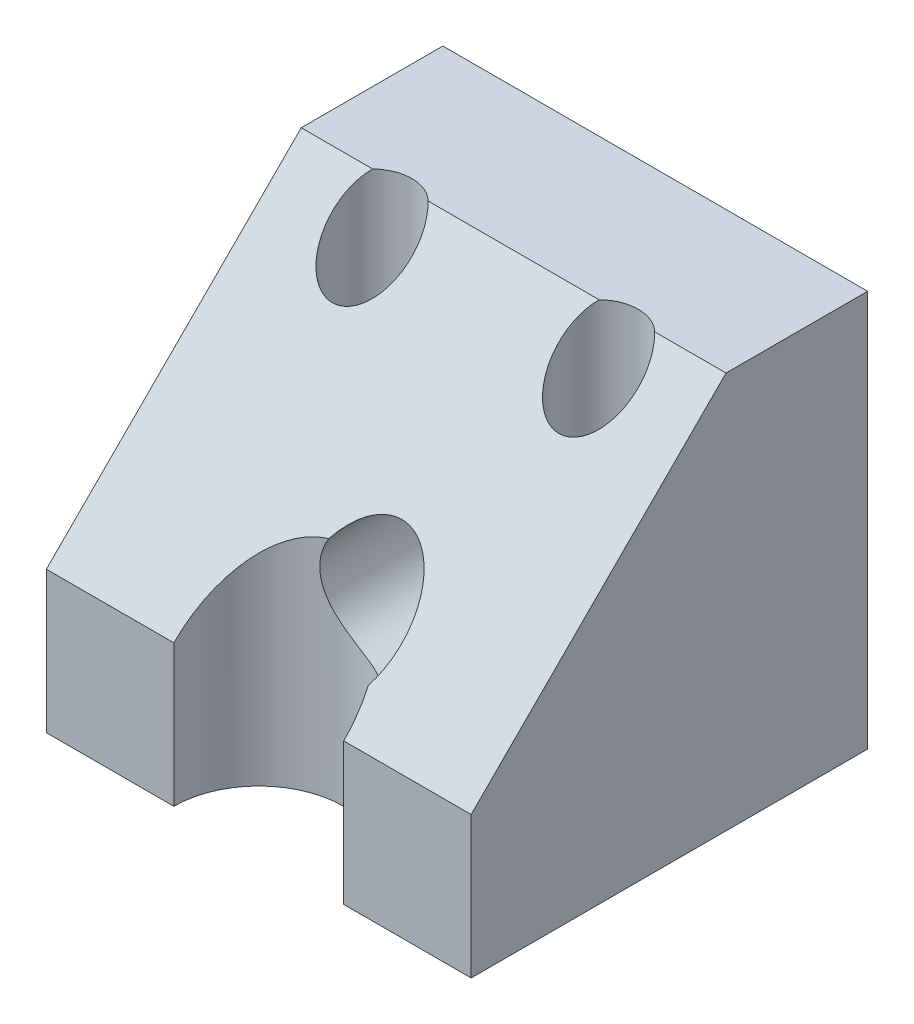
from build123d import *

# Parameters (mm, degrees)
EXTRUDE_1_DEPTH          = 15
CUT_EXTRUDE_1_DEPTH      = 25.839484697
CUT_EXTRUDE_1_DEPTH_BACK = 25.839484697
SKETCH_2_R               = 1.4
SKETCH_3_R               = 1.9
CUT_EXTRUDE_2_DEPTH      = 25.839484697
SKETCH_4_R               = 3
CUT_EXTRUDE_3_DEPTH      = 25.839484753


with BuildPart() as part:
    # 草图1 → 凸台-拉伸1 (new body)
    with BuildSketch(Plane(origin=(0, 0, 0), x_dir=(0, 0, -1), z_dir=(1, 0, 0))):
        Polygon((-14, 0), (0, 0), (0, 14), (-5, 14), (-14, 5), align=None)
    extrude(amount=EXTRUDE_1_DEPTH)

    # 草图2 → 切除-拉伸1 (cut, two sides: drawn at the far end of the back side and taken through both)
    with BuildSketch(Plane.XZ.offset(-CUT_EXTRUDE_1_DEPTH_BACK)):
        with Locations(Location((11.5, 6, 0), (0, 0, 225.584691403))):
            Circle(SKETCH_2_R)
        with Locations(Location((3.5, 6, 0), (0, 0, 225.584691403))):
            Circle(SKETCH_2_R)
    extrude(amount=CUT_EXTRUDE_1_DEPTH + CUT_EXTRUDE_1_DEPTH_BACK, mode=Mode.SUBTRACT)

    # 草图3 → 切除-拉伸2 (cut, through all)
    with BuildSketch(Plane(origin=(0, 0, 0), x_dir=(-1, 0, 0), z_dir=(0, 0, -1))):
        with Locations((-8.65, 7)):
            Circle(SKETCH_3_R)
    extrude(amount=-CUT_EXTRUDE_2_DEPTH, mode=Mode.SUBTRACT)

    # 草图4 → 切除-拉伸3 (cut, through all)
    with BuildSketch(Plane.XZ):
        with Locations((7.5, 14)):
            Circle(SKETCH_4_R)
    extrude(amount=-CUT_EXTRUDE_3_DEPTH, mode=Mode.SUBTRACT)


solid = part.part
